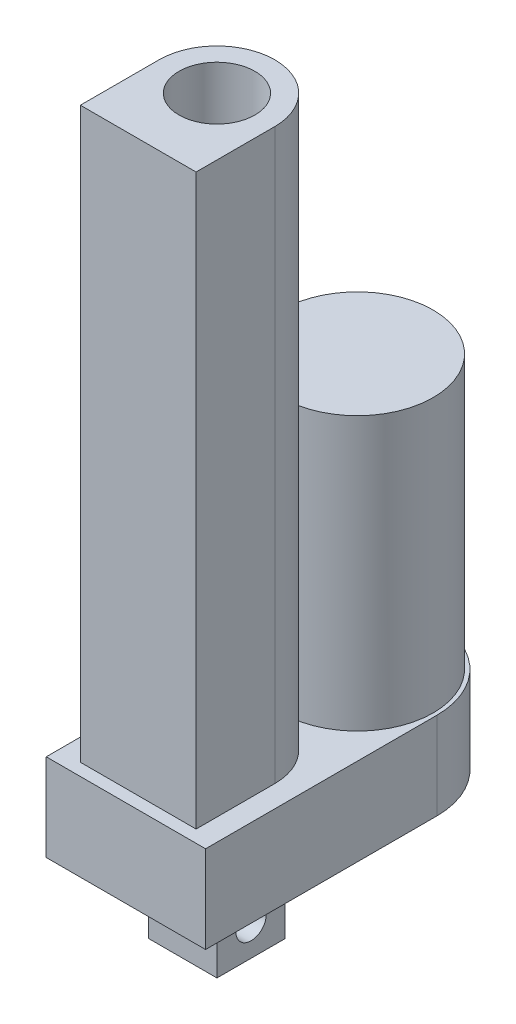
from build123d import *

# Parameters (mm, degrees)
BOSS_EXTRUDE1_DEPTH     = 23
SKETCH2_W               = 18
SKETCH2_H               = 18
BOSS_EXTRUDE2_DEPTH     = 20
CUT_EXTRUDE1_DEPTH      = 76.193084788
CUT_EXTRUDE1_DEPTH_BACK = 76.193084788
SKETCH3_R               = 4
SKETCH4_R               = 20
BOSS_EXTRUDE3_DEPTH     = 95
SKETCH5_R               = 10
BOSS_EXTRUDE4_DEPTH     = 150


with BuildPart() as part:
    # Sketch1 → Boss-Extrude1 (new body)
    with BuildSketch(Plane(origin=(0, 0, 0), x_dir=(1, 0, 0), z_dir=(0, 1, 0))):
        with BuildLine():
            Line((-21, -24), (21, -24))
            Line((21, -24), (21, 37))
            ThreePointArc((21, 37), (0, 58), (-21, 37))
            Line((-21, 37), (-21, -24))
        make_face()
    extrude(amount=-BOSS_EXTRUDE1_DEPTH)

    # Sketch2 → Boss-Extrude2 (add)
    with BuildSketch(Plane.XZ.offset(23)):
        Rectangle(SKETCH2_W, SKETCH2_H)
    extrude(amount=BOSS_EXTRUDE2_DEPTH)

    # Sketch3 → Cut-Extrude1 (cut, two sides: drawn at the far end of the back side and taken through both)
    with BuildSketch(Plane(origin=(0, 0, 0), x_dir=(0, 0, -1), z_dir=(1, 0, 0)).offset(-CUT_EXTRUDE1_DEPTH_BACK)):
        with Locations((0, -35)):
            Circle(SKETCH3_R)
    extrude(amount=CUT_EXTRUDE1_DEPTH + CUT_EXTRUDE1_DEPTH_BACK, mode=Mode.SUBTRACT)

    # Sketch4 → Boss-Extrude3 (add)
    with BuildSketch(Plane.XZ.offset(23)):
        with Locations(Location((0, -37, 0), (0, 0, 270))):
            Circle(SKETCH4_R)
    extrude(amount=-BOSS_EXTRUDE3_DEPTH)

    # Sketch5 → Boss-Extrude4 (add)
    with BuildSketch(Plane(origin=(0, 0, 0), x_dir=(1, 0, 0), z_dir=(0, 1, 0))):
        with BuildLine():
            Line((-15.25, 0), (-15.25, -20.75))
            Line((-15.25, -20.75), (15.25, -20.75))
            Line((15.25, -20.75), (15.25, 0))
            ThreePointArc((15.25, 0), (0, 15.25), (-15.25, 0))
        make_face()
        with Locations(Location((0, 0, 0), (0, 0, 270))):
            Circle(SKETCH5_R, mode=Mode.SUBTRACT)
    extrude(amount=BOSS_EXTRUDE4_DEPTH)


solid = part.part
